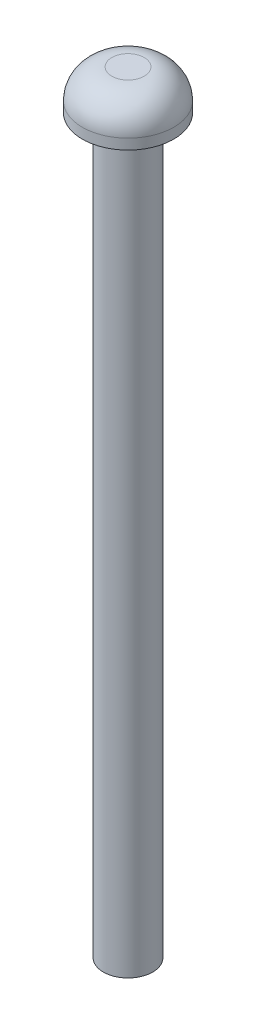
from build123d import *

# Parameters (mm, degrees)
CROQUIS1_R              = 1.675
SALIENTE_EXTRUIR1_DEPTH = 49.65
CROQUIS2_R              = 3.1
SALIENTE_EXTRUIR2_DEPTH = 2.7
REDONDEO1_R             = 2


with BuildPart() as part:
    # Croquis1 → Saliente-Extruir1 (new body)
    with BuildSketch(Plane(origin=(0, 0, 0), x_dir=(1, 0, 0), z_dir=(0, 1, 0))):
        with Locations(Location((0, 0, 0), (0, 0, 270))):
            Circle(CROQUIS1_R)
    extrude(amount=-SALIENTE_EXTRUIR1_DEPTH)

    # Croquis2 → Saliente-Extruir2 (add)
    with BuildSketch(Plane(origin=(0, 0, 0), x_dir=(1, 0, 0), z_dir=(0, 1, 0))):
        with Locations(Location((0, 0, 0), (0, 0, 90))):
            Circle(CROQUIS2_R)
    extrude(amount=SALIENTE_EXTRUIR2_DEPTH)

    # Redondeo1
    redondeo1_edges = [part.edges().sort_by_distance(p)[0] for p in [
        (0, 2.7, 3.1),
    ]]
    fillet(redondeo1_edges, radius=REDONDEO1_R)


solid = part.part
